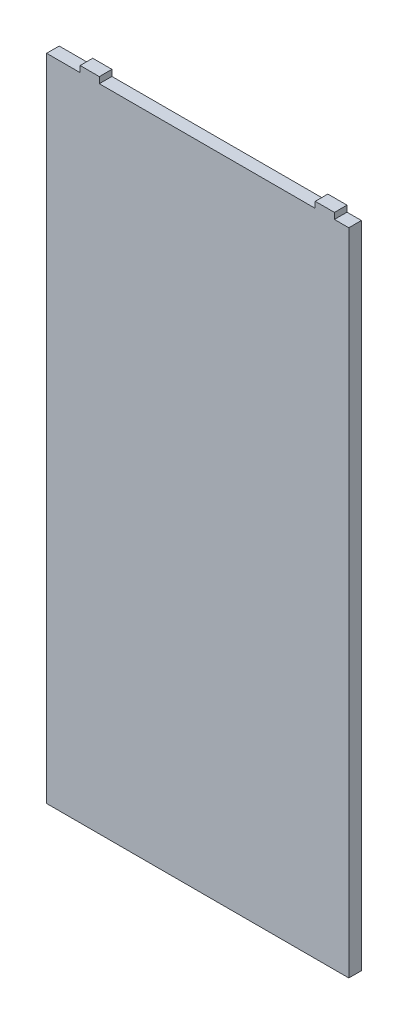
from build123d import *

# Parameters (mm, degrees)
SKETCH1_W               = 24
SKETCH1_H               = 51.6
BOSS_EXTRUDE1_DEPTH     = 1
SKETCH2_W               = 1.52454199
SKETCH2_H               = 0.68782272
BOSS_EXTRUDE2_DEPTH     = 1
CUT_EXTRUDE1_DEPTH      = 30.156315931
CUT_EXTRUDE1_DEPTH_BACK = 0.5


with BuildPart() as part:
    # Sketch1 → Boss-Extrude1 (new body)
    with BuildSketch(Plane.XY):
        with Locations((-0.014342532, -0.747058824)):
            Rectangle(SKETCH1_W, SKETCH1_H)
    extrude(amount=BOSS_EXTRUDE1_DEPTH)

    # Sketch2 → Boss-Extrude2 (add)
    with BuildSketch(Plane(origin=(0, 0, 0), x_dir=(-1, 0, 0), z_dir=(0, 0, -1))):
        with Locations((-10.081520714, 25.194355877)):
            Rectangle(SKETCH2_W, SKETCH2_H)
        with Locations((8.590054208, 25.199009148)):
            Rectangle(SKETCH2_W, SKETCH2_H)
    extrude(amount=-BOSS_EXTRUDE2_DEPTH)

    # Sketch3 → Cut-Extrude1 (cut, two sides: drawn at the far end of the back side and taken through both)
    with BuildSketch(Plane(origin=(0, 0, 0), x_dir=(-1, 0, 0), z_dir=(0, 0, -1)).offset(-CUT_EXTRUDE1_DEPTH_BACK)):
        with BuildLine():
            Line((-3.38328462, -26.547058824), (3.544014575, -26.547058824))
            ThreePointArc((3.544014575, -26.547058824), (0.080364977, -23.092635137), (-3.38328462, -26.547058824))
        make_face()
    extrude(amount=CUT_EXTRUDE1_DEPTH + CUT_EXTRUDE1_DEPTH_BACK, mode=Mode.SUBTRACT)


solid = part.part
